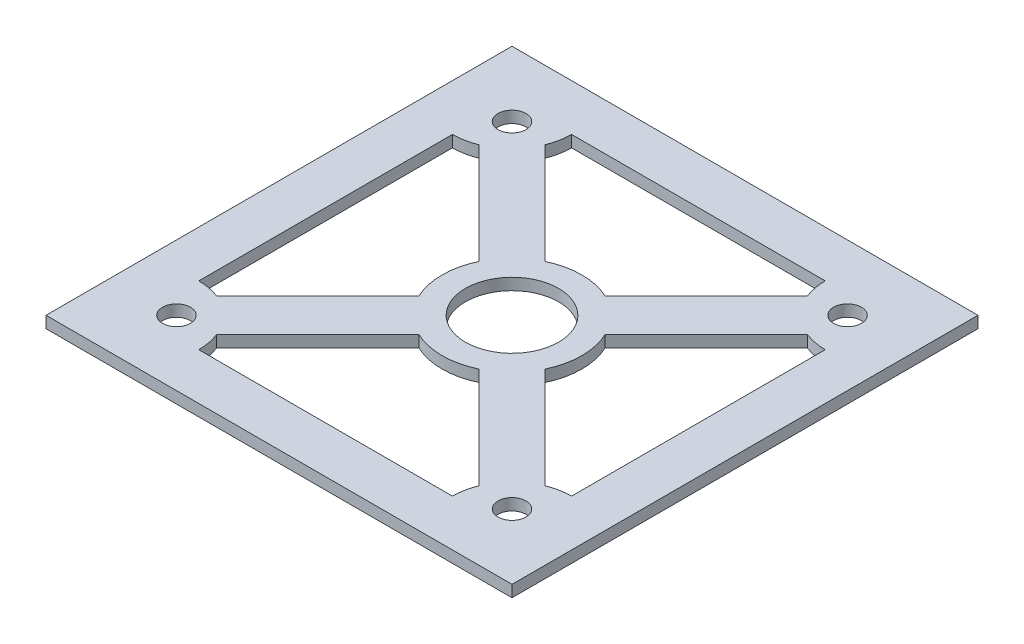
from build123d import *

# Parameters (mm, degrees)
SKETCH1_W           = 100
SKETCH1_H           = 100
BOSS_EXTRUDE1_DEPTH = 2.5
SKETCH5_W           = 80
SKETCH5_H           = 80
CUT_EXTRUDE2_DEPTH  = 4
SKETCH6_R           = 15
BOSS_EXTRUDE3_DEPTH = 2.5
SKETCH7_W           = 5
SKETCH7_H           = 5
CUT_EXTRUDE3_DEPTH  = 2.5
BOSS_EXTRUDE4_DEPTH = 2.5
EXTRUDE_THIN2_DEPTH = 2.5
SKETCH10_R          = 3
CUT_EXTRUDE5_DEPTH  = 2.5
SKETCH12_R          = 10
CUT_EXTRUDE7_DEPTH  = 10


with BuildPart() as part:
    # Sketch1 → Boss-Extrude1 (new body)
    with BuildSketch(Plane(origin=(0, 0, 0), x_dir=(1, 0, 0), z_dir=(0, 1, 0))):
        Rectangle(SKETCH1_W, SKETCH1_H)
    extrude(amount=BOSS_EXTRUDE1_DEPTH)

    # Sketch5 → Cut-Extrude2 (cut)
    with BuildSketch(Plane(origin=(0, 2.5, 0), x_dir=(1, 0, 0), z_dir=(0, 1, 0))):
        Rectangle(SKETCH5_W, SKETCH5_H)
    extrude(amount=-CUT_EXTRUDE2_DEPTH, mode=Mode.SUBTRACT)

    # Sketch8 → Boss-Extrude4 (add)
    with BuildSketch(Plane(origin=(0, 2.5, 0), x_dir=(1, 0, 0), z_dir=(0, 1, 0))):
        with BuildLine():
            Line((-40, -40), (-27.220069463, -40))
            ThreePointArc((-27.220069463, -40), (-30.963224454, -30.963224454), (-40, -27.220069463))
            Line((-40, -27.220069463), (-40, -40))
        make_face()
        with BuildLine():
            ThreePointArc((-40, 27.220069463), (-30.963224454, 30.963224454), (-27.220069463, 40))
            Line((-27.220069463, 40), (-40, 40))
            Line((-40, 40), (-40, 27.220069463))
        make_face()
        with BuildLine():
            Line((40, 40), (27.220069463, 40))
            ThreePointArc((27.220069463, 40), (30.963224454, 30.963224454), (40, 27.220069463))
            Line((40, 27.220069463), (40, 40))
        make_face()
        with BuildLine():
            ThreePointArc((40, -27.220069463), (30.963224454, -30.963224454), (27.220069463, -40))
            Line((27.220069463, -40), (40, -40))
            Line((40, -40), (40, -27.220069463))
        make_face()
    extrude(amount=-BOSS_EXTRUDE4_DEPTH)



with BuildPart() as body_2:
    # Sketch6 → Boss-Extrude3 (new body)
    with BuildSketch(Plane(origin=(0, 2.5, 0), x_dir=(1, 0, 0), z_dir=(0, 1, 0))):
        with Locations(Location((0, 0, 0), (0, 0, 270))):
            Circle(SKETCH6_R)
    extrude(amount=-BOSS_EXTRUDE3_DEPTH)

    # Sketch7 → Cut-Extrude3 (cut)
    with BuildSketch(Plane(origin=(0, 2.5, 0), x_dir=(1, 0, 0), z_dir=(0, 1, 0))):
        Rectangle(SKETCH7_W, SKETCH7_H)
    extrude(amount=-CUT_EXTRUDE3_DEPTH, mode=Mode.SUBTRACT)


with BuildPart() as part_1:
    add(part.part)

    add(body_2.part)  # Extrude-Thin2 merges body 2
    # Sketch9 → Extrude-Thin2 (add)
    with BuildSketch(Plane(origin=(0, 2.5, 0), x_dir=(1, 0, 0), z_dir=(0, 1, 0))):
        Polygon((-1.035533906, -6.035533906), (34.46870341, -41.539771222), (41.539771222, -34.46870341), (6.035533906, 1.035533906), align=None)
        Polygon((-11.285533906, -4.214466094), (-41.539771222, -34.46870341), (-34.46870341, -41.539771222), (-4.214466094, -11.285533906), align=None)
        Polygon((11.285533906, 4.214466094), (41.539771222, 34.46870341), (34.46870341, 41.539771222), (4.214466094, 11.285533906), align=None)
        Polygon((-4.214466094, 11.285533906), (-34.46870341, 41.539771222), (-41.539771222, 34.46870341), (-11.285533906, 4.214466094), align=None)
    extrude(amount=-EXTRUDE_THIN2_DEPTH)

    # Sketch10 → Cut-Extrude5 (cut)
    with BuildSketch(Plane(origin=(0, 2.5, 0), x_dir=(1, 0, 0), z_dir=(0, 1, 0))):
        with Locations(Location((36, 36, 0), (0, 0, 270))):
            Circle(SKETCH10_R)
        with Locations(Location((-36, 36, 0), (0, 0, 90))):
            Circle(SKETCH10_R)
        with Locations(Location((36, -36, 0), (0, 0, 90))):
            Circle(SKETCH10_R)
        with Locations(Location((-36, -36, 0), (0, 0, 270))):
            Circle(SKETCH10_R)
    extrude(amount=-CUT_EXTRUDE5_DEPTH, mode=Mode.SUBTRACT)

    # Sketch12 → Cut-Extrude7 (cut)
    with BuildSketch(Plane(origin=(0, 2.5, 0), x_dir=(1, 0, 0), z_dir=(0, 1, 0))):
        with Locations(Location((0, 0, 0), (0, 0, 270))):
            Circle(SKETCH12_R)
    extrude(amount=-CUT_EXTRUDE7_DEPTH, mode=Mode.SUBTRACT)


solid = part_1.part
